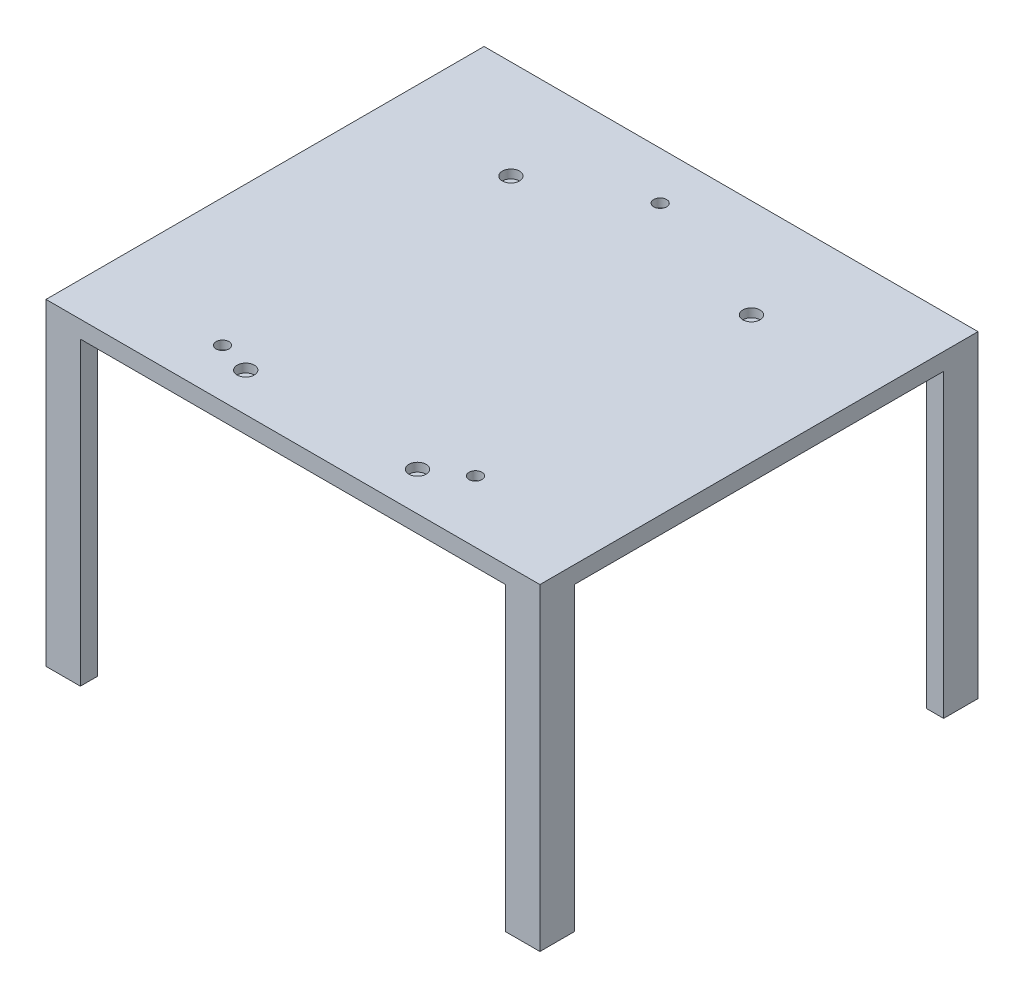
from build123d import *

# Parameters (mm, degrees)
SKETCH1_W           = 115
SKETCH1_H           = 102
BOSS_EXTRUDE1_DEPTH = 4
SKETCH3_W           = 15
SKETCH3_H           = 90
BOSS_EXTRUDE2_DEPTH = 40
SKETCH4_R           = 2.125
CUT_EXTRUDE4_DEPTH  = 10
SKETCH11_W          = 104
SKETCH11_H          = 91
CUT_EXTRUDE5_DEPTH  = 2
SKETCH14_R          = 1
CUT_EXTRUDE7_DEPTH  = 20
BOSS_EXTRUDE4_DEPTH = 70
SKETCH13_R          = 1
CUT_EXTRUDE6_DEPTH  = 20
SKETCH7_W           = 115
SKETCH7_H           = 102
BOSS_EXTRUDE5_DEPTH = 4
SKETCH8_R           = 2
CUT_EXTRUDE2_DEPTH  = 2
SKETCH9_R           = 1.5
CUT_EXTRUDE3_DEPTH  = 2
SKETCH15_W          = 168.231856539
SKETCH15_H          = 129.587124708
CUT_EXTRUDE8_DEPTH  = 171.601875722


with BuildPart() as part:
    # Sketch1 → Boss-Extrude1 (new body)
    with BuildSketch(Plane(origin=(0, 0, 0), x_dir=(1, 0, 0), z_dir=(0, 1, 0))):
        with Locations((57.5, 51)):
            Rectangle(SKETCH1_W, SKETCH1_H)
    extrude(amount=BOSS_EXTRUDE1_DEPTH)

    # Sketch3 → Boss-Extrude2 (add)
    with BuildSketch(Plane.XZ):
        with Locations((13, -51)):
            Rectangle(SKETCH3_W, SKETCH3_H)
        with Locations((102, -51)):
            Rectangle(SKETCH3_W, SKETCH3_H)
    extrude(amount=BOSS_EXTRUDE2_DEPTH)

    # Sketch4 → Cut-Extrude4 (cut)
    with BuildSketch(Plane.XZ.offset(40)):
        with Locations(Location((14.525, -67.125, 0), (0, 0, 270))):
            Circle(SKETCH4_R)
        with Locations(Location((14.525, -34.875, 0), (0, 0, 270))):
            Circle(SKETCH4_R)
        with Locations(Location((100.475, -67.125, 0), (0, 0, 270))):
            Circle(SKETCH4_R)
        with Locations(Location((100.475, -34.875, 0), (0, 0, 270))):
            Circle(SKETCH4_R)
    extrude(amount=-CUT_EXTRUDE4_DEPTH, mode=Mode.SUBTRACT)

    # Sketch11 → Cut-Extrude5 (cut)
    with BuildSketch(Plane(origin=(0, 4, 0), x_dir=(1, 0, 0), z_dir=(0, 1, 0))):
        with Locations((57.5, 51)):
            Rectangle(SKETCH11_W, SKETCH11_H)
    extrude(amount=-CUT_EXTRUDE5_DEPTH, mode=Mode.SUBTRACT)

    # Sketch14 → Cut-Extrude7 (cut)
    with BuildSketch(Plane.XZ):
        with Locations(Location((109, -100, 0), (0, 0, 270))):
            Circle(SKETCH14_R)
        with Locations(Location((113, -96, 0), (0, 0, 270))):
            Circle(SKETCH14_R)
        with Locations(Location((2, -96, 0), (0, 0, 270))):
            Circle(SKETCH14_R)
        with Locations(Location((6, -100, 0), (0, 0, 270))):
            Circle(SKETCH14_R)
        with Locations(Location((113, -6, 0), (0, 0, 270))):
            Circle(SKETCH14_R)
        with Locations(Location((109, -2, 0), (0, 0, 270))):
            Circle(SKETCH14_R)
        with Locations(Location((2, -6, 0), (0, 0, 270))):
            Circle(SKETCH14_R)
        with Locations(Location((6, -2, 0), (0, 0, 270))):
            Circle(SKETCH14_R)
    extrude(amount=-CUT_EXTRUDE7_DEPTH, mode=Mode.SUBTRACT)

    # Sketch6 → Boss-Extrude4 (add)
    with BuildSketch(Plane(origin=(0, 4, 0), x_dir=(1, 0, 0), z_dir=(0, 1, 0))):
        Polygon((0, 0), (0, 8), (4, 8), (4, 4), (8, 4), (8, 0), align=None)
        Polygon((107, 0), (115, 0), (115, 8), (111, 8), (111, 4), (107, 4), align=None)
        Polygon((107, 102), (115, 102), (115, 94), (111, 94), (111, 98), (107, 98), align=None)
        Polygon((8, 102), (0, 102), (0, 94), (4, 94), (4, 98), (8, 98), align=None)
    extrude(amount=BOSS_EXTRUDE4_DEPTH)

    # Sketch13 → Cut-Extrude6 (cut)
    with BuildSketch(Plane.XZ):
        with Locations(Location((109, -100, 0), (0, 0, 270))):
            Circle(SKETCH13_R)
        with Locations(Location((113, -96, 0), (0, 0, 270))):
            Circle(SKETCH13_R)
        with Locations(Location((2, -96, 0), (0, 0, 90))):
            Circle(SKETCH13_R)
        with Locations(Location((6, -100, 0), (0, 0, 90))):
            Circle(SKETCH13_R)
        with Locations(Location((113, -6, 0), (0, 0, 90))):
            Circle(SKETCH13_R)
        with Locations(Location((109, -2, 0), (0, 0, 90))):
            Circle(SKETCH13_R)
        with Locations(Location((6, -2, 0), (0, 0, 270))):
            Circle(SKETCH13_R)
        with Locations(Location((2, -6, 0), (0, 0, 270))):
            Circle(SKETCH13_R)
    extrude(amount=-CUT_EXTRUDE6_DEPTH, mode=Mode.SUBTRACT)

    # Sketch7 → Boss-Extrude5 (add)
    with BuildSketch(Plane(origin=(0, 74, 0), x_dir=(1, 0, 0), z_dir=(0, 1, 0))):
        with Locations((57.5, 51)):
            Rectangle(SKETCH7_W, SKETCH7_H)
    extrude(amount=BOSS_EXTRUDE5_DEPTH)

    # Sketch8 → Cut-Extrude2 (cut)
    with BuildSketch(Plane(origin=(0, 78, 0), x_dir=(1, 0, 0), z_dir=(0, 1, 0))):
        with Locations(Location((29.25, 79, 0), (0, 0, 270))):
            Circle(SKETCH8_R)
        with Locations(Location((85.25, 79, 0), (0, 0, 270))):
            Circle(SKETCH8_R)
        with Locations(Location((37.5, 9, 0), (0, 0, 270))):
            Circle(SKETCH8_R)
        with Locations(Location((77.5, 9, 0), (0, 0, 270))):
            Circle(SKETCH8_R)
    extrude(amount=-CUT_EXTRUDE2_DEPTH, mode=Mode.SUBTRACT)

    # Sketch9 → Cut-Extrude3 (cut)
    with BuildSketch(Plane(origin=(0, 78, 0), x_dir=(1, 0, 0), z_dir=(0, 1, 0))):
        with Locations(Location((52.1, 90.9, 0), (0, 0, 270))):
            Circle(SKETCH9_R)
        with Locations(Location((85.6, 14.4, 0), (0, 0, 270))):
            Circle(SKETCH9_R)
        with Locations(Location((29.8, 11.3, 0), (0, 0, 270))):
            Circle(SKETCH9_R)
    extrude(amount=-CUT_EXTRUDE3_DEPTH, mode=Mode.SUBTRACT)

    # Sketch15 → Cut-Extrude8 (cut, through all)
    with BuildSketch(Plane(origin=(0, 4, 0), x_dir=(1, 0, 0), z_dir=(0, 1, 0))):
        with Locations((71.077613374, 52.272730689)):
            Rectangle(SKETCH15_W, SKETCH15_H)
    extrude(amount=-CUT_EXTRUDE8_DEPTH, mode=Mode.SUBTRACT)


solid = part.part
